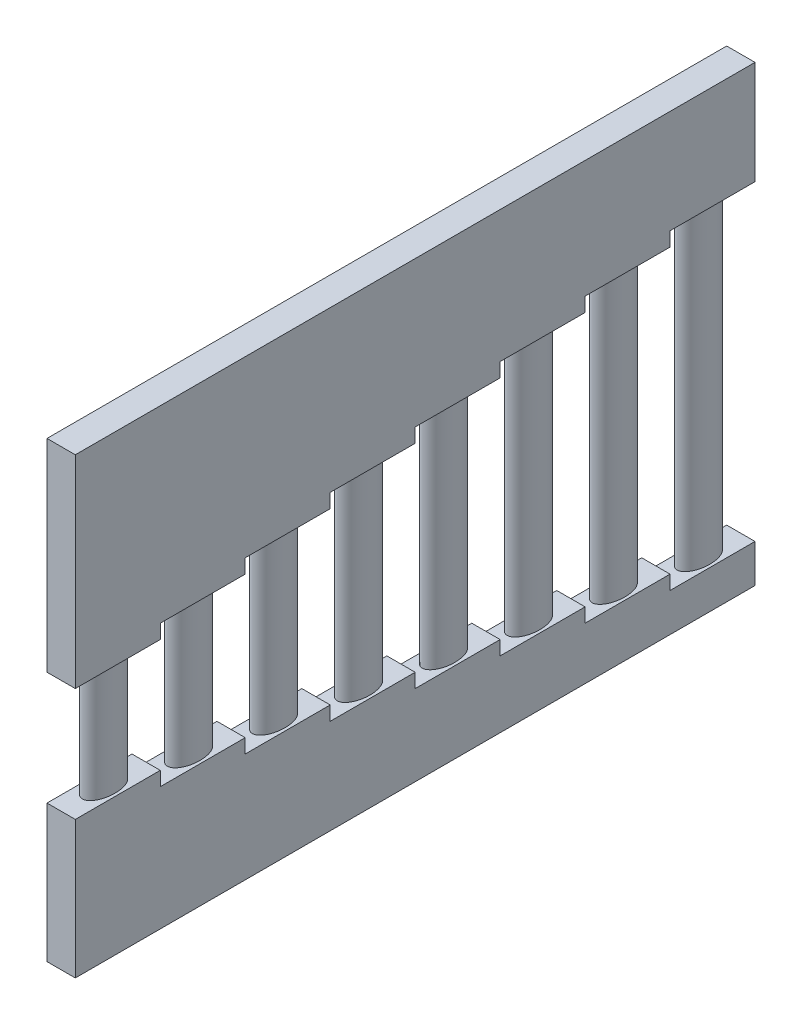
from build123d import *

# Parameters (mm, degrees)
BOSS_EXTRUDE1_DEPTH      = 48
CUT_EXTRUDE4_DEPTH       = 2
CUT_EXTRUDE6_DEPTH       = 9
CUT_EXTRUDE6_DEPTH_BACK  = 1
SKETCH8_RX               = 1.5
SKETCH8_RY               = 0.8
CUT_EXTRUDE7_DEPTH       = 11
CUT_EXTRUDE7_DEPTH_BACK  = 1
SKETCH13_RX              = 1.5
SKETCH13_RY              = 0.8
CUT_EXTRUDE8_DEPTH       = 13
CUT_EXTRUDE8_DEPTH_BACK  = 1
SKETCH14_RX              = 1.5
SKETCH14_RY              = 0.8
CUT_EXTRUDE9_DEPTH       = 15
CUT_EXTRUDE9_DEPTH_BACK  = 1
SKETCH15_RX              = 1.5
SKETCH15_RY              = 0.8
CUT_EXTRUDE10_DEPTH      = 17
CUT_EXTRUDE10_DEPTH_BACK = 1
SKETCH16_RX              = 1.5
SKETCH16_RY              = 0.8
CUT_EXTRUDE11_DEPTH      = 19
CUT_EXTRUDE11_DEPTH_BACK = 1
SKETCH17_RX              = 1.5
SKETCH17_RY              = 0.8
CUT_EXTRUDE12_DEPTH      = 21
CUT_EXTRUDE12_DEPTH_BACK = 1
SKETCH18_RX              = 1.5
SKETCH18_RY              = 0.8
CUT_EXTRUDE13_DEPTH      = 23
CUT_EXTRUDE13_DEPTH_BACK = 1
SKETCH19_RX              = 1.5
SKETCH19_RY              = 0.8
SKETCH8_4_RX             = 1.5
SKETCH8_4_RY             = 0.8
BOSS_EXTRUDE2_DEPTH      = 10
SKETCH13_3_RX            = 1.5
SKETCH13_3_RY            = 0.8
BOSS_EXTRUDE3_DEPTH      = 10
SKETCH14_3_RX            = 1.5
SKETCH14_3_RY            = 0.8
BOSS_EXTRUDE4_DEPTH      = 12
SKETCH15_3_RX            = 1.5
SKETCH15_3_RY            = 0.8
BOSS_EXTRUDE5_DEPTH      = 14
SKETCH16_3_RX            = 1.5
SKETCH16_3_RY            = 0.8
BOSS_EXTRUDE6_DEPTH      = 16
SKETCH17_3_RX            = 1.5
SKETCH17_3_RY            = 0.8
BOSS_EXTRUDE7_DEPTH      = 18
SKETCH18_3_RX            = 1.5
SKETCH18_3_RY            = 0.8
BOSS_EXTRUDE8_DEPTH      = 20
SKETCH19_3_RX            = 1.5
SKETCH19_3_RY            = 0.8
BOSS_EXTRUDE9_DEPTH      = 22


with BuildPart() as part:
    # Sketch2 → Boss-Extrude1 (new body)
    with BuildSketch(Plane.XY):
        Polygon((-7.23, -20.3), (-7.23, -34), (-9.23, -34), (-9.23, -2), (-7.23, -2), align=None)
    extrude(amount=BOSS_EXTRUDE1_DEPTH)

    # Sketch7 → Cut-Extrude4 (cut)
    with BuildSketch(Plane(origin=(-7.23, 0, 0), x_dir=(0, 0, -1), z_dir=(1, 0, 0))):
        Polygon((-48, -16.3), (-48, -24.3), (-42, -24.3), (-42, -25.3), (-36, -25.3), (-36, -26.3), (-30, -26.3), (-30, -27.3), (-24, -27.3), (-24, -28.3), (-18, -28.3), (-18, -29.3), (-12, -29.3), (-12, -30.3), (-6, -30.3), (-6, -31.3), (0, -31.3), (0, -9.3), (-6, -9.3), (-6, -10.3), (-12, -10.3), (-12, -11.3), (-18, -11.3), (-18, -12.3), (-24, -12.3), (-24, -13.3), (-30, -13.3), (-30, -14.3), (-36, -14.3), (-36, -15.3), (-42, -15.3), (-42, -16.3), align=None)
    extrude(amount=-CUT_EXTRUDE4_DEPTH, mode=Mode.SUBTRACT)


with BuildPart() as cut_extrude4_piece_1:
    # of the separate pieces the step leaves, piece 1, a body of its own (cut_extrude4_pieces)
    add(part.part.solids().sort_by_distance((-7.23, -9.3, 0))[0])


with BuildPart() as cut_extrude4_piece_2:
    # of the separate pieces the step leaves, piece 2, a body of its own (cut_extrude4_pieces)
    add(part.part.solids().sort_by_distance((-7.23, -34, 0))[0])


with BuildPart() as cut_extrude6_tool:
    # Sketch8 → Cut-Extrude6 (new, two sides: drawn at the far end of the back side and taken through both)
    with BuildSketch(Plane(origin=(0, -24.3, 0), x_dir=(1, 0, 0), z_dir=(0, 1, 0)).offset(-CUT_EXTRUDE6_DEPTH_BACK)):
        with Locations(Location((-8.23, -45), (0, 0, 90))):
            Ellipse(SKETCH8_RX, SKETCH8_RY)
    extrude(amount=CUT_EXTRUDE6_DEPTH + CUT_EXTRUDE6_DEPTH_BACK)


with BuildPart() as cut_extrude4_piece_1_1:
    add(cut_extrude4_piece_1.part)

    # Cut-Extrude6: cut by cut_extrude6_tool
    add(cut_extrude6_tool.part, mode=Mode.SUBTRACT)


with BuildPart() as cut_extrude4_piece_2_1:
    add(cut_extrude4_piece_2.part)

    # Cut-Extrude6: cut by cut_extrude6_tool
    add(cut_extrude6_tool.part, mode=Mode.SUBTRACT)


with BuildPart() as cut_extrude7_tool:
    # Sketch13 → Cut-Extrude7 (new, two sides: drawn at the far end of the back side and taken through both)
    with BuildSketch(Plane(origin=(0, -25.3, 0), x_dir=(1, 0, 0), z_dir=(0, 1, 0)).offset(-CUT_EXTRUDE7_DEPTH_BACK)):
        with Locations(Location((-8.23, -39), (0, 0, 90))):
            Ellipse(SKETCH13_RX, SKETCH13_RY)
    extrude(amount=CUT_EXTRUDE7_DEPTH + CUT_EXTRUDE7_DEPTH_BACK)


with BuildPart() as cut_extrude4_piece_1_2:
    add(cut_extrude4_piece_1_1.part)

    # Cut-Extrude7: cut by cut_extrude7_tool
    add(cut_extrude7_tool.part, mode=Mode.SUBTRACT)


with BuildPart() as cut_extrude4_piece_2_2:
    add(cut_extrude4_piece_2_1.part)

    # Cut-Extrude7: cut by cut_extrude7_tool
    add(cut_extrude7_tool.part, mode=Mode.SUBTRACT)


with BuildPart() as cut_extrude8_tool:
    # Sketch14 → Cut-Extrude8 (new, two sides: drawn at the far end of the back side and taken through both)
    with BuildSketch(Plane(origin=(0, -26.3, 0), x_dir=(1, 0, 0), z_dir=(0, 1, 0)).offset(-CUT_EXTRUDE8_DEPTH_BACK)):
        with Locations(Location((-8.23, -33), (0, 0, 90))):
            Ellipse(SKETCH14_RX, SKETCH14_RY)
    extrude(amount=CUT_EXTRUDE8_DEPTH + CUT_EXTRUDE8_DEPTH_BACK)


with BuildPart() as cut_extrude4_piece_1_3:
    add(cut_extrude4_piece_1_2.part)

    # Cut-Extrude8: cut by cut_extrude8_tool
    add(cut_extrude8_tool.part, mode=Mode.SUBTRACT)


with BuildPart() as cut_extrude4_piece_2_3:
    add(cut_extrude4_piece_2_2.part)

    # Cut-Extrude8: cut by cut_extrude8_tool
    add(cut_extrude8_tool.part, mode=Mode.SUBTRACT)


with BuildPart() as cut_extrude9_tool:
    # Sketch15 → Cut-Extrude9 (new, two sides: drawn at the far end of the back side and taken through both)
    with BuildSketch(Plane(origin=(0, -27.3, 0), x_dir=(1, 0, 0), z_dir=(0, 1, 0)).offset(-CUT_EXTRUDE9_DEPTH_BACK)):
        with Locations(Location((-8.23, -27), (0, 0, 90))):
            Ellipse(SKETCH15_RX, SKETCH15_RY)
    extrude(amount=CUT_EXTRUDE9_DEPTH + CUT_EXTRUDE9_DEPTH_BACK)


with BuildPart() as cut_extrude4_piece_1_4:
    add(cut_extrude4_piece_1_3.part)

    # Cut-Extrude9: cut by cut_extrude9_tool
    add(cut_extrude9_tool.part, mode=Mode.SUBTRACT)


with BuildPart() as cut_extrude4_piece_2_4:
    add(cut_extrude4_piece_2_3.part)

    # Cut-Extrude9: cut by cut_extrude9_tool
    add(cut_extrude9_tool.part, mode=Mode.SUBTRACT)


with BuildPart() as cut_extrude10_tool:
    # Sketch16 → Cut-Extrude10 (new, two sides: drawn at the far end of the back side and taken through both)
    with BuildSketch(Plane(origin=(0, -28.3, 0), x_dir=(1, 0, 0), z_dir=(0, 1, 0)).offset(-CUT_EXTRUDE10_DEPTH_BACK)):
        with Locations(Location((-8.23, -21), (0, 0, 90))):
            Ellipse(SKETCH16_RX, SKETCH16_RY)
    extrude(amount=CUT_EXTRUDE10_DEPTH + CUT_EXTRUDE10_DEPTH_BACK)


with BuildPart() as cut_extrude4_piece_1_5:
    add(cut_extrude4_piece_1_4.part)

    # Cut-Extrude10: cut by cut_extrude10_tool
    add(cut_extrude10_tool.part, mode=Mode.SUBTRACT)


with BuildPart() as cut_extrude4_piece_2_5:
    add(cut_extrude4_piece_2_4.part)

    # Cut-Extrude10: cut by cut_extrude10_tool
    add(cut_extrude10_tool.part, mode=Mode.SUBTRACT)


with BuildPart() as cut_extrude11_tool:
    # Sketch17 → Cut-Extrude11 (new, two sides: drawn at the far end of the back side and taken through both)
    with BuildSketch(Plane(origin=(0, -29.3, 0), x_dir=(1, 0, 0), z_dir=(0, 1, 0)).offset(-CUT_EXTRUDE11_DEPTH_BACK)):
        with Locations(Location((-8.23, -15), (0, 0, 90))):
            Ellipse(SKETCH17_RX, SKETCH17_RY)
    extrude(amount=CUT_EXTRUDE11_DEPTH + CUT_EXTRUDE11_DEPTH_BACK)


with BuildPart() as cut_extrude4_piece_1_6:
    add(cut_extrude4_piece_1_5.part)

    # Cut-Extrude11: cut by cut_extrude11_tool
    add(cut_extrude11_tool.part, mode=Mode.SUBTRACT)


with BuildPart() as cut_extrude4_piece_2_6:
    add(cut_extrude4_piece_2_5.part)

    # Cut-Extrude11: cut by cut_extrude11_tool
    add(cut_extrude11_tool.part, mode=Mode.SUBTRACT)


with BuildPart() as cut_extrude12_tool:
    # Sketch18 → Cut-Extrude12 (new, two sides: drawn at the far end of the back side and taken through both)
    with BuildSketch(Plane(origin=(0, -30.3, 0), x_dir=(1, 0, 0), z_dir=(0, 1, 0)).offset(-CUT_EXTRUDE12_DEPTH_BACK)):
        with Locations(Location((-8.23, -9), (0, 0, 90))):
            Ellipse(SKETCH18_RX, SKETCH18_RY)
    extrude(amount=CUT_EXTRUDE12_DEPTH + CUT_EXTRUDE12_DEPTH_BACK)


with BuildPart() as cut_extrude4_piece_1_7:
    add(cut_extrude4_piece_1_6.part)

    # Cut-Extrude12: cut by cut_extrude12_tool
    add(cut_extrude12_tool.part, mode=Mode.SUBTRACT)


with BuildPart() as cut_extrude4_piece_2_7:
    add(cut_extrude4_piece_2_6.part)

    # Cut-Extrude12: cut by cut_extrude12_tool
    add(cut_extrude12_tool.part, mode=Mode.SUBTRACT)


with BuildPart() as cut_extrude13_tool:
    # Sketch19 → Cut-Extrude13 (new, two sides: drawn at the far end of the back side and taken through both)
    with BuildSketch(Plane(origin=(0, -31.3, 0), x_dir=(1, 0, 0), z_dir=(0, 1, 0)).offset(-CUT_EXTRUDE13_DEPTH_BACK)):
        with Locations(Location((-8.23, -3), (0, 0, 90))):
            Ellipse(SKETCH19_RX, SKETCH19_RY)
    extrude(amount=CUT_EXTRUDE13_DEPTH + CUT_EXTRUDE13_DEPTH_BACK)


with BuildPart() as cut_extrude4_piece_1_8:
    add(cut_extrude4_piece_1_7.part)

    # Cut-Extrude13: cut by cut_extrude13_tool
    add(cut_extrude13_tool.part, mode=Mode.SUBTRACT)



with BuildPart() as cut_extrude4_piece_2_8:
    add(cut_extrude4_piece_2_7.part)

    # Cut-Extrude13: cut by cut_extrude13_tool
    add(cut_extrude13_tool.part, mode=Mode.SUBTRACT)


with BuildPart() as cut_extrude4_piece_1_9:
    add(cut_extrude4_piece_1_8.part)

    add(cut_extrude4_piece_2_8.part)  # Boss-Extrude2 merges Cut-Extrude4 piece 2
    # Sketch8<4> → Boss-Extrude2 (add)
    with BuildSketch(Plane(origin=(0, -24.3, 0), x_dir=(1, 0, 0), z_dir=(0, 1, 0))):
        with Locations(Location((-8.23, -45), (0, 0, 90))):
            Ellipse(SKETCH8_4_RX, SKETCH8_4_RY)
    extrude(amount=BOSS_EXTRUDE2_DEPTH)


with BuildPart() as body_2:
    # Sketch13<3> → Boss-Extrude3 (new body)
    with BuildSketch(Plane(origin=(0, -25.3, 0), x_dir=(1, 0, 0), z_dir=(0, 1, 0))):
        with Locations(Location((-8.23, -39), (0, 0, 90))):
            Ellipse(SKETCH13_3_RX, SKETCH13_3_RY)
    extrude(amount=BOSS_EXTRUDE3_DEPTH)


with BuildPart() as body_3:
    # Sketch14<3> → Boss-Extrude4 (new body)
    with BuildSketch(Plane(origin=(0, -26.3, 0), x_dir=(1, 0, 0), z_dir=(0, 1, 0))):
        with Locations(Location((-8.23, -33), (0, 0, 90))):
            Ellipse(SKETCH14_3_RX, SKETCH14_3_RY)
    extrude(amount=BOSS_EXTRUDE4_DEPTH)


with BuildPart() as body_4:
    # Sketch15<3> → Boss-Extrude5 (new body)
    with BuildSketch(Plane(origin=(0, -27.3, 0), x_dir=(1, 0, 0), z_dir=(0, 1, 0))):
        with Locations(Location((-8.23, -27), (0, 0, 90))):
            Ellipse(SKETCH15_3_RX, SKETCH15_3_RY)
    extrude(amount=BOSS_EXTRUDE5_DEPTH)


with BuildPart() as body_5:
    # Sketch16<3> → Boss-Extrude6 (new body)
    with BuildSketch(Plane(origin=(0, -28.3, 0), x_dir=(1, 0, 0), z_dir=(0, 1, 0))):
        with Locations(Location((-8.23, -21), (0, 0, 90))):
            Ellipse(SKETCH16_3_RX, SKETCH16_3_RY)
    extrude(amount=BOSS_EXTRUDE6_DEPTH)


with BuildPart() as body_6:
    # Sketch17<3> → Boss-Extrude7 (new body)
    with BuildSketch(Plane(origin=(0, -29.3, 0), x_dir=(1, 0, 0), z_dir=(0, 1, 0))):
        with Locations(Location((-8.23, -15), (0, 0, 90))):
            Ellipse(SKETCH17_3_RX, SKETCH17_3_RY)
    extrude(amount=BOSS_EXTRUDE7_DEPTH)


with BuildPart() as body_7:
    # Sketch18<3> → Boss-Extrude8 (new body)
    with BuildSketch(Plane(origin=(0, -30.3, 0), x_dir=(1, 0, 0), z_dir=(0, 1, 0))):
        with Locations(Location((-8.23, -9), (0, 0, 90))):
            Ellipse(SKETCH18_3_RX, SKETCH18_3_RY)
    extrude(amount=BOSS_EXTRUDE8_DEPTH)


with BuildPart() as body_8:
    # Sketch19<3> → Boss-Extrude9 (new body)
    with BuildSketch(Plane(origin=(0, -31.3, 0), x_dir=(1, 0, 0), z_dir=(0, 1, 0))):
        with Locations(Location((-8.23, -3), (0, 0, 90))):
            Ellipse(SKETCH19_3_RX, SKETCH19_3_RY)
    extrude(amount=BOSS_EXTRUDE9_DEPTH)


solid = Compound([cut_extrude4_piece_1_9.part, body_2.part, body_3.part, body_4.part, body_5.part, body_6.part, body_7.part, body_8.part])
